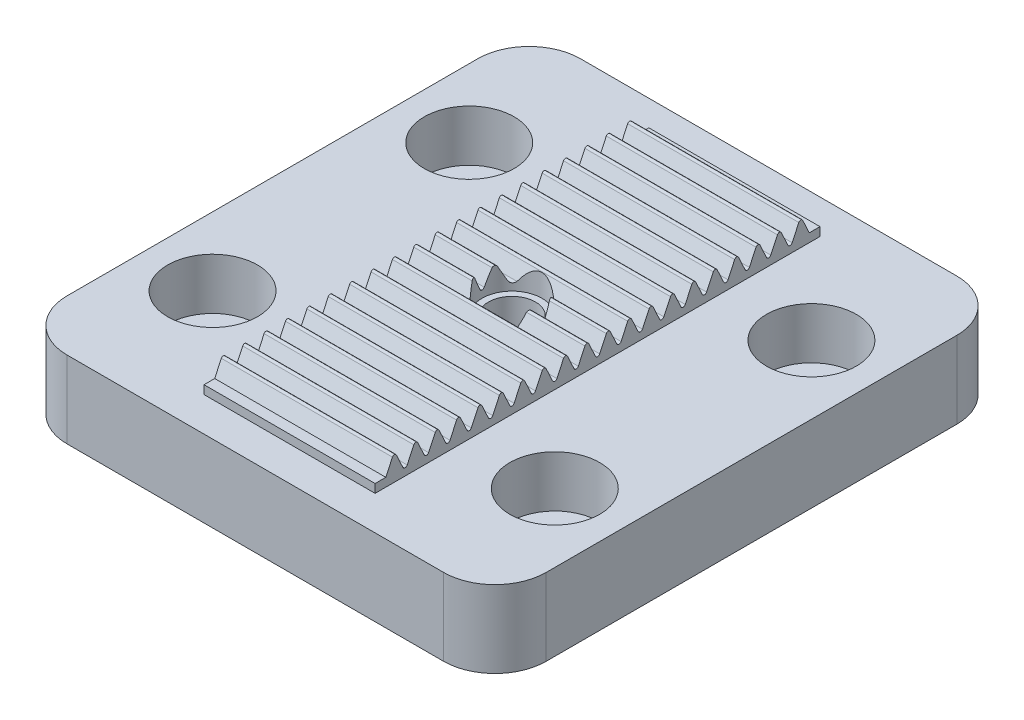
from build123d import *

# Parameters (mm, degrees)
SKETCH1_W           = 56
SKETCH1_H           = 60
SKETCH1_R           = 3.25
BOSS_EXTRUDE1_DEPTH = 3
SKETCH2_W           = 56
SKETCH2_H           = 60
SKETCH2_R           = 5.25
BOSS_EXTRUDE2_DEPTH = 6
FILLET1_R           = 6
BOSS_EXTRUDE3_DEPTH = 10
SKETCH4_R           = 2.75
CUT_EXTRUDE2_DEPTH  = 43.700231647
SKETCH5_R           = 3.5
CUT_EXTRUDE3_DEPTH  = 43.011903097
CUT_EXTRUDE4_DEPTH  = 5


with BuildPart() as part:
    # Sketch1 → Boss-Extrude1 (new body)
    with BuildSketch(Plane(origin=(0, 0, 0), x_dir=(1, 0, 0), z_dir=(0, 1, 0))):
        Rectangle(SKETCH1_W, SKETCH1_H)
        with Locations(Location((-20, 15, 0), (0, 0, 270))):
            Circle(SKETCH1_R, mode=Mode.SUBTRACT)
        with Locations(Location((-20, -15, 0), (0, 0, 270))):
            Circle(SKETCH1_R, mode=Mode.SUBTRACT)
        with Locations(Location((20, -15, 0), (0, 0, 270))):
            Circle(SKETCH1_R, mode=Mode.SUBTRACT)
        with Locations(Location((20, 15, 0), (0, 0, 270))):
            Circle(SKETCH1_R, mode=Mode.SUBTRACT)
    extrude(amount=BOSS_EXTRUDE1_DEPTH)

    # Sketch2 → Boss-Extrude2 (add)
    with BuildSketch(Plane(origin=(0, 3, 0), x_dir=(1, 0, 0), z_dir=(0, 1, 0))):
        Rectangle(SKETCH2_W, SKETCH2_H)
        with Locations(Location((-20, 15, 0), (0, 0, 270))):
            Circle(SKETCH2_R, mode=Mode.SUBTRACT)
        with Locations(Location((-20, -15, 0), (0, 0, 270))):
            Circle(SKETCH2_R, mode=Mode.SUBTRACT)
        with Locations(Location((20, -15, 0), (0, 0, 270))):
            Circle(SKETCH2_R, mode=Mode.SUBTRACT)
        with Locations(Location((20, 15, 0), (0, 0, 270))):
            Circle(SKETCH2_R, mode=Mode.SUBTRACT)
    extrude(amount=BOSS_EXTRUDE2_DEPTH)

    # Fillet1
    fillet1_edges = [part.edges().sort_by_distance(p)[0] for p in [
        (28, 4.5, 30),
        (-28, 4.5, 30),
        (-28, 4.5, -30),
        (28, 4.5, -30),
    ]]
    fillet(fillet1_edges, radius=FILLET1_R)

    # Sketch3 → Boss-Extrude3 (add, symmetric)
    with BuildSketch(Plane(origin=(0, 0, 0), x_dir=(0, 0, -1), z_dir=(1, 0, 0))):
        with BuildLine():
            Line((-26, 9), (-26, 10))
            Line((-26, 10), (-24.75, 10))
            Line((-24.75, 10), (-23.976576947, 11.65861109))
            ThreePointArc((-23.976576947, 11.65861109), (-23.75, 11.802956525), (-23.523423053, 11.65861109))
            Line((-23.523423053, 11.65861109), (-22.75, 10))
            ThreePointArc((-22.75, 10), (-22.5, 9.840732435), (-22.25, 10))
            Line((-22.25, 10), (-21.476576947, 11.65861109))
            ThreePointArc((-21.476576947, 11.65861109), (-21.25, 11.802956525), (-21.023423053, 11.65861109))
            Line((-21.023423053, 11.65861109), (-20.25, 10))
            ThreePointArc((-20.25, 10), (-20, 9.840732435), (-19.75, 10))
            Line((-19.75, 10), (-18.976576947, 11.65861109))
            ThreePointArc((-18.976576947, 11.65861109), (-18.75, 11.802956525), (-18.523423053, 11.65861109))
            Line((-18.523423053, 11.65861109), (-17.75, 10))
            ThreePointArc((-17.75, 10), (-17.5, 9.840732435), (-17.25, 10))
            Line((-17.25, 10), (-16.476576947, 11.65861109))
            ThreePointArc((-16.476576947, 11.65861109), (-16.25, 11.802956525), (-16.023423053, 11.65861109))
            Line((-16.023423053, 11.65861109), (-15.25, 10))
            ThreePointArc((-15.25, 10), (-15, 9.840732435), (-14.75, 10))
            Line((-14.75, 10), (-13.976576947, 11.65861109))
            ThreePointArc((-13.976576947, 11.65861109), (-13.75, 11.802956525), (-13.523423053, 11.65861109))
            Line((-13.523423053, 11.65861109), (-12.75, 10))
            ThreePointArc((-12.75, 10), (-12.5, 9.840732435), (-12.25, 10))
            Line((-12.25, 10), (-11.476576947, 11.65861109))
            ThreePointArc((-11.476576947, 11.65861109), (-11.25, 11.802956525), (-11.023423053, 11.65861109))
            Line((-11.023423053, 11.65861109), (-10.25, 10))
            ThreePointArc((-10.25, 10), (-10, 9.840732435), (-9.75, 10))
            Line((-9.75, 10), (-8.976576947, 11.65861109))
            ThreePointArc((-8.976576947, 11.65861109), (-8.75, 11.802956525), (-8.523423053, 11.65861109))
            Line((-8.523423053, 11.65861109), (-7.75, 10))
            ThreePointArc((-7.75, 10), (-7.5, 9.840732435), (-7.25, 10))
            Line((-7.25, 10), (-6.476576947, 11.65861109))
            ThreePointArc((-6.476576947, 11.65861109), (-6.25, 11.802956525), (-6.023423053, 11.65861109))
            Line((-6.023423053, 11.65861109), (-5.25, 10))
            ThreePointArc((-5.25, 10), (-5, 9.840732435), (-4.75, 10))
            Line((-4.75, 10), (-3.976576947, 11.65861109))
            ThreePointArc((-3.976576947, 11.65861109), (-3.75, 11.802956525), (-3.523423053, 11.65861109))
            Line((-3.523423053, 11.65861109), (-2.75, 10))
            ThreePointArc((-2.75, 10), (-2.5, 9.840732435), (-2.25, 10))
            Line((-2.25, 10), (-1.476576947, 11.65861109))
            ThreePointArc((-1.476576947, 11.65861109), (-1.25, 11.802956525), (-1.023423053, 11.65861109))
            Line((-1.023423053, 11.65861109), (-0.25, 10))
            ThreePointArc((-0.25, 10), (0, 9.840732435), (0.25, 10))
            Line((0.25, 10), (1.023423053, 11.65861109))
            ThreePointArc((1.023423053, 11.65861109), (1.25, 11.802956525), (1.476576947, 11.65861109))
            Line((1.476576947, 11.65861109), (2.25, 10))
            ThreePointArc((2.25, 10), (2.5, 9.840732435), (2.75, 10))
            Line((2.75, 10), (3.523423053, 11.65861109))
            ThreePointArc((3.523423053, 11.65861109), (3.75, 11.802956525), (3.976576947, 11.65861109))
            Line((3.976576947, 11.65861109), (4.75, 10))
            ThreePointArc((4.75, 10), (5, 9.840732435), (5.25, 10))
            Line((5.25, 10), (6.023423053, 11.65861109))
            ThreePointArc((6.023423053, 11.65861109), (6.25, 11.802956525), (6.476576947, 11.65861109))
            Line((6.476576947, 11.65861109), (7.25, 10))
            ThreePointArc((7.25, 10), (7.5, 9.840732435), (7.75, 10))
            Line((7.75, 10), (8.523423053, 11.65861109))
            ThreePointArc((8.523423053, 11.65861109), (8.75, 11.802956525), (8.976576947, 11.65861109))
            Line((8.976576947, 11.65861109), (9.75, 10))
            ThreePointArc((9.75, 10), (10, 9.840732435), (10.25, 10))
            Line((10.25, 10), (11.023423053, 11.65861109))
            ThreePointArc((11.023423053, 11.65861109), (11.25, 11.802956525), (11.476576947, 11.65861109))
            Line((11.476576947, 11.65861109), (12.25, 10))
            ThreePointArc((12.25, 10), (12.5, 9.840732435), (12.75, 10))
            Line((12.75, 10), (13.523423053, 11.65861109))
            ThreePointArc((13.523423053, 11.65861109), (13.75, 11.802956525), (13.976576947, 11.65861109))
            Line((13.976576947, 11.65861109), (14.75, 10))
            ThreePointArc((14.75, 10), (15, 9.840732435), (15.25, 10))
            Line((15.25, 10), (16.023423053, 11.65861109))
            ThreePointArc((16.023423053, 11.65861109), (16.25, 11.802956525), (16.476576947, 11.65861109))
            Line((16.476576947, 11.65861109), (17.25, 10))
            ThreePointArc((17.25, 10), (17.5, 9.840732435), (17.75, 10))
            Line((17.75, 10), (18.523423053, 11.65861109))
            ThreePointArc((18.523423053, 11.65861109), (18.75, 11.802956525), (18.976576947, 11.65861109))
            Line((18.976576947, 11.65861109), (19.75, 10))
            ThreePointArc((19.75, 10), (20, 9.840732435), (20.25, 10))
            Line((20.25, 10), (21.023423053, 11.65861109))
            ThreePointArc((21.023423053, 11.65861109), (21.25, 11.802956525), (21.476576947, 11.65861109))
            Line((21.476576947, 11.65861109), (22.25, 10))
            ThreePointArc((22.25, 10), (22.5, 9.840732435), (22.75, 10))
            Line((22.75, 10), (23.523423053, 11.65861109))
            ThreePointArc((23.523423053, 11.65861109), (23.75, 11.802956525), (23.976576947, 11.65861109))
            Line((23.976576947, 11.65861109), (24.75, 10))
            Line((24.75, 10), (26, 10))
            Line((26, 10), (26, 9))
            Line((26, 9), (-26, 9))
        make_face()
    extrude(amount=BOSS_EXTRUDE3_DEPTH, both=True)

    # Sketch4 → Cut-Extrude2 (cut, through all)
    with BuildSketch(Plane(origin=(0, 0, 0), x_dir=(1, 0, 0), z_dir=(0, 1, 0))):
        with Locations(Location((0, 0, 0), (0, 0, 90.000000079))):
            Circle(SKETCH4_R)
    extrude(amount=CUT_EXTRUDE2_DEPTH, mode=Mode.SUBTRACT)

    # Sketch5 → Cut-Extrude3 (cut, through all)
    with BuildSketch(Plane(origin=(0, 9, 0), x_dir=(1, 0, 0), z_dir=(0, 1, 0))):
        with Locations(Location((0, 0, 0), (0, 0, 128.213210702))):
            Circle(SKETCH5_R)
    extrude(amount=CUT_EXTRUDE3_DEPTH, mode=Mode.SUBTRACT)

    # Sketch6 → Cut-Extrude4 (cut)
    with BuildSketch(Plane.XZ):
        Polygon((4.25, -2.453738644), (4.25, 2.453738644), (0, 4.907477288), (-4.25, 2.453738644), (-4.25, -2.453738644), (0, -4.907477288), align=None)
    extrude(amount=-CUT_EXTRUDE4_DEPTH, mode=Mode.SUBTRACT)


solid = part.part
